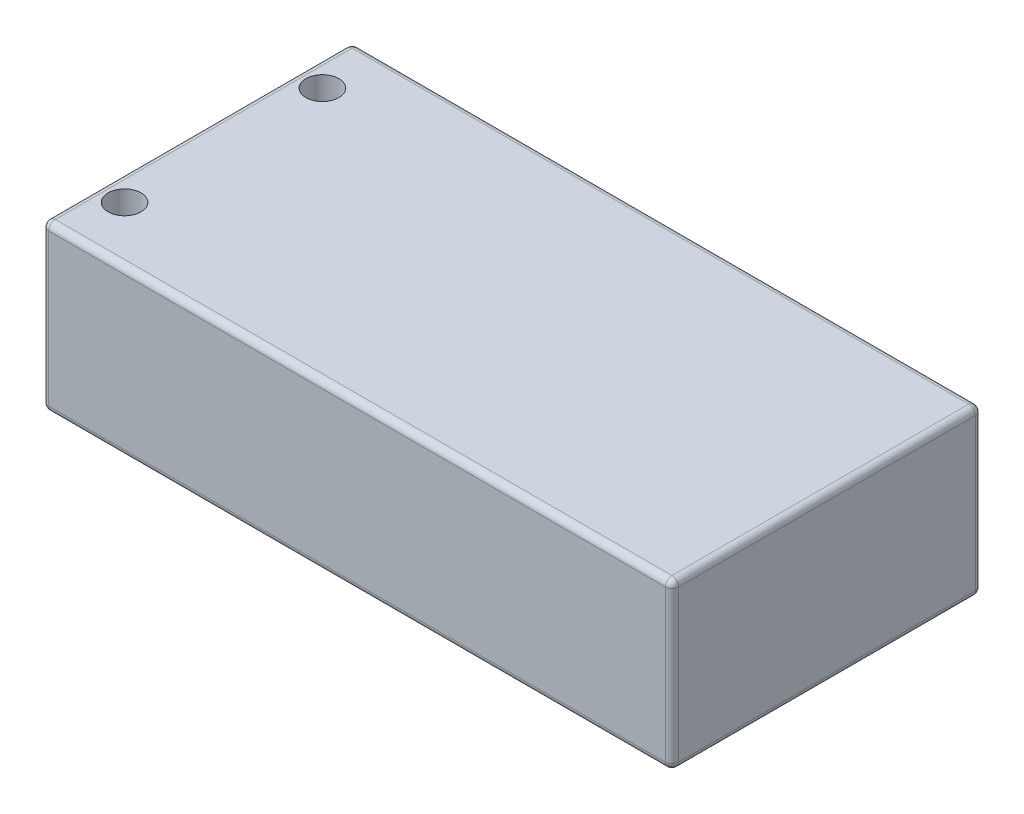
from build123d import *

# Parameters (mm, degrees)
SKETCH1_W           = 95.5
SKETCH1_H           = 47
BOSS_EXTRUDE1_DEPTH = 25
SKETCH2_R           = 2.5
CUT_EXTRUDE1_DEPTH  = 20
FILLET1_R           = 1


with BuildPart() as part:
    # Sketch1 → Boss-Extrude1 (new body)
    with BuildSketch(Plane(origin=(0, 0, 0), x_dir=(1, 0, 0), z_dir=(0, 1, 0))):
        Rectangle(SKETCH1_W, SKETCH1_H)
    extrude(amount=BOSS_EXTRUDE1_DEPTH)

    # Sketch2 → Cut-Extrude1 (cut)
    with BuildSketch(Plane(origin=(0, 25, 0), x_dir=(1, 0, 0), z_dir=(0, 1, 0))):
        with Locations(Location((-43.75, 15, 0), (0, 0, 270))):
            Circle(SKETCH2_R)
        with Locations(Location((-43.75, -15, 0), (0, 0, 270))):
            Circle(SKETCH2_R)
    extrude(amount=-CUT_EXTRUDE1_DEPTH, mode=Mode.SUBTRACT)

    # Fillet1
    fillet1_edges = [part.edges().sort_by_distance(p)[0] for p in [
        (-47.75, 25, 0),
        (0, 25, 23.5),
        (47.75, 25, 0),
        (0, 0, 23.5),
        (-47.75, 0, 0),
        (0, 0, -23.5),
        (47.75, 0, 0),
        (47.75, 12.5, 23.5),
        (-47.75, 12.5, 23.5),
        (-47.75, 12.5, -23.5),
        (47.75, 12.5, -23.5),
        (0, 25, -23.5),
    ]]
    fillet(fillet1_edges, radius=FILLET1_R)


solid = part.part
